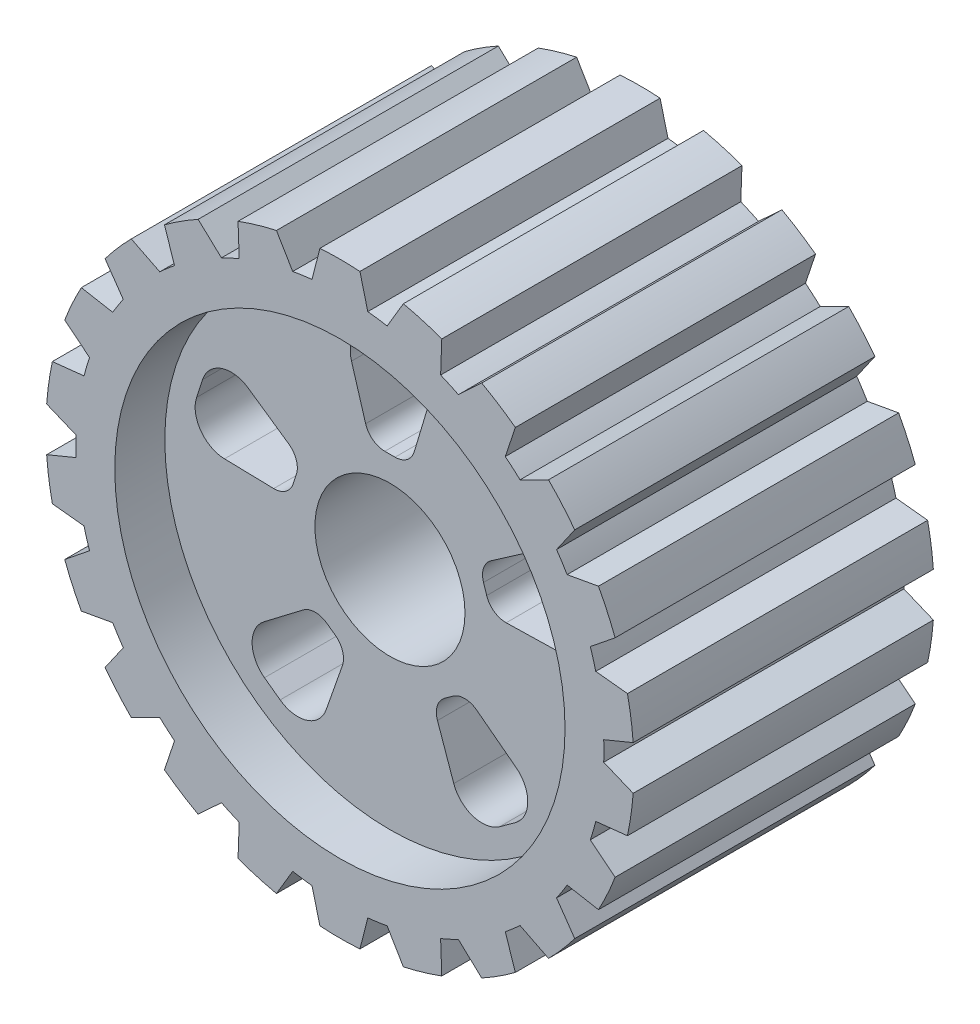
from build123d import *

# Parameters (mm, degrees)
SKETCH_1_R      = 22.5
EXTRUDE_1_DEPTH = 15
SKETCH_2_R      = 22.5
SKETCH_2_R_2    = 7.5
EXTRUDE_2_DEPTH = 10


with BuildPart() as part:
    # Эскиз1 → Бобышка-Вытянуть1 (new, symmetric)
    with BuildSketch(Plane.XY):
        with BuildLine():
            ThreePointArc((2, 29.320868353), (0, 29.389), (-2, 29.320868353))
            Line((-2, 29.320868353), (-2.786729363, 26.234406101))
            ThreePointArc((-2.786729363, 26.234406101), (-3.268466839, 26.178751852), (-3.749099963, 26.114252305))
            ThreePointArc((-3.749099963, 26.114252305), (-3.754550063, 26.11346928), (-3.76, 26.112685117))
            ThreePointArc((-3.76, 26.112685117), (-4.239335727, 26.039161979), (-4.717239065, 25.956840709))
            Line((-4.717239065, 25.956840709), (-6.341657263, 28.696632279))
            ThreePointArc((-6.341657263, 28.696632279), (-8.279838113, 28.198539002), (-10.179629157, 27.569702052))
            Line((-10.179629157, 27.569702052), (-10.064933551, 24.386615932))
            ThreePointArc((-10.064933551, 24.386615932), (-10.511477661, 24.19749494), (-10.954470144, 24.00019808))
            ThreePointArc((-10.954470144, 24.00019808), (-10.959478873, 23.997911301), (-10.964487125, 23.995623478))
            ThreePointArc((-10.964487125, 23.995623478), (-11.403692526, 23.790034064), (-11.839044838, 23.576406455))
            Line((-11.839044838, 23.576406455), (-14.169551169, 25.747565723))
            ThreePointArc((-14.169551169, 25.747565723), (-15.888892984, 24.723600076), (-17.534565301, 23.585002453))
            Line((-17.534565301, 23.585002453), (-16.527736682, 20.563167173))
            ThreePointArc((-16.527736682, 20.563167173), (-16.902911077, 20.255900897), (-17.272374303, 19.94179054))
            ThreePointArc((-17.272374303, 19.94179054), (-17.276535883, 19.938185271), (-17.280696711, 19.934579132))
            ThreePointArc((-17.280696711, 19.934579132), (-17.644189976, 19.613579074), (-18.001721608, 19.285951964))
            Line((-18.001721608, 19.285951964), (-20.84951231, 20.712584519))
            ThreePointArc((-20.84951231, 20.712584519), (-22.210724241, 19.24570211), (-23.468955246, 17.689586221))
            Line((-23.468955246, 17.689586221), (-21.65156088, 15.073812904))
            ThreePointArc((-21.65156088, 15.073812904), (-21.924971162, 14.673294229), (-22.190973418, 14.26781773))
            ThreePointArc((-22.190973418, 14.26781773), (-22.193950703, 14.263186046), (-22.196927022, 14.258553741))
            ThreePointArc((-22.196927022, 14.258553741), (-22.455260088, 13.848148554), (-22.706005954, 13.433064343))
            Line((-22.706005954, 13.433064343), (-25.84036996, 13.999592899))
            ThreePointArc((-25.84036996, 13.999592899), (-26.733174711, 12.208631817), (-27.502030012, 10.361064918))
            Line((-27.502030012, 10.361064918), (-25.021304383, 8.36326796))
            ThreePointArc((-25.021304383, 8.36326796), (-25.170800477, 7.901944528), (-25.311791842, 7.437951181))
            ThreePointArc((-25.311791842, 7.437951181), (-25.31334363, 7.432668315), (-25.314894316, 7.427385125))
            ThreePointArc((-25.314894316, 7.427385125), (-25.447138575, 6.960823396), (-25.570784735, 6.491909738))
            Line((-25.570784735, 6.491909738), (-28.737794514, 6.152437522))
            ThreePointArc((-28.737794514, 6.152437522), (-29.089862355, 4.182490782), (-29.307053867, 2.193151754))
            Line((-29.307053867, 2.193151754), (-26.363970612, 0.975180785))
            ThreePointArc((-26.363970612, 0.975180785), (-26.377441234, 0.490426276), (-26.381999425, 0.005506062))
            ThreePointArc((-26.381999425, 0.005506062), (-26.382, 0), (-26.381999425, -0.005506062))
            ThreePointArc((-26.381999425, -0.005506062), (-26.377441234, -0.490426276), (-26.363970612, -0.975180785))
            Line((-26.363970612, -0.975180785), (-29.307053867, -2.193151754))
            ThreePointArc((-29.307053867, -2.193151754), (-29.089862355, -4.182490782), (-28.737794514, -6.152437522))
            Line((-28.737794514, -6.152437522), (-25.570784735, -6.491909738))
            ThreePointArc((-25.570784735, -6.491909738), (-25.447138575, -6.960823396), (-25.314894316, -7.427385125))
            ThreePointArc((-25.314894316, -7.427385125), (-25.31334363, -7.432668315), (-25.311791842, -7.437951181))
            ThreePointArc((-25.311791842, -7.437951181), (-25.170800477, -7.901944528), (-25.021304383, -8.36326796))
            Line((-25.021304383, -8.36326796), (-27.502030012, -10.361064918))
            ThreePointArc((-27.502030012, -10.361064918), (-26.733174711, -12.208631817), (-25.84036996, -13.999592899))
            Line((-25.84036996, -13.999592899), (-22.706005954, -13.433064343))
            ThreePointArc((-22.706005954, -13.433064343), (-22.455260088, -13.848148554), (-22.196927022, -14.258553741))
            ThreePointArc((-22.196927022, -14.258553741), (-22.193950703, -14.263186046), (-22.190973418, -14.26781773))
            ThreePointArc((-22.190973418, -14.26781773), (-21.924971162, -14.673294229), (-21.65156088, -15.073812904))
            Line((-21.65156088, -15.073812904), (-23.468955246, -17.689586221))
            ThreePointArc((-23.468955246, -17.689586221), (-22.210724241, -19.24570211), (-20.84951231, -20.712584519))
            Line((-20.84951231, -20.712584519), (-18.001721608, -19.285951964))
            ThreePointArc((-18.001721608, -19.285951964), (-17.644189976, -19.613579074), (-17.280696711, -19.934579132))
            ThreePointArc((-17.280696711, -19.934579132), (-17.276535883, -19.938185271), (-17.272374303, -19.94179054))
            ThreePointArc((-17.272374303, -19.94179054), (-16.902911077, -20.255900897), (-16.527736682, -20.563167173))
            Line((-16.527736682, -20.563167173), (-17.534565301, -23.585002453))
            ThreePointArc((-17.534565301, -23.585002453), (-15.888892984, -24.723600076), (-14.169551169, -25.747565723))
            Line((-14.169551169, -25.747565723), (-11.839044838, -23.576406455))
            ThreePointArc((-11.839044838, -23.576406455), (-11.403692526, -23.790034064), (-10.964487125, -23.995623478))
            ThreePointArc((-10.964487125, -23.995623478), (-10.959478873, -23.997911301), (-10.954470144, -24.00019808))
            ThreePointArc((-10.954470144, -24.00019808), (-10.511477661, -24.19749494), (-10.064933551, -24.386615932))
            Line((-10.064933551, -24.386615932), (-10.179629157, -27.569702052))
            ThreePointArc((-10.179629157, -27.569702052), (-8.279838113, -28.198539002), (-6.341657263, -28.696632279))
            Line((-6.341657263, -28.696632279), (-4.717239065, -25.956840709))
            ThreePointArc((-4.717239065, -25.956840709), (-4.239335727, -26.039161979), (-3.76, -26.112685117))
            ThreePointArc((-3.76, -26.112685117), (-3.754550063, -26.11346928), (-3.749099963, -26.114252305))
            ThreePointArc((-3.749099963, -26.114252305), (-3.268466839, -26.178751852), (-2.786729363, -26.234406101))
            Line((-2.786729363, -26.234406101), (-2, -29.320868353))
            ThreePointArc((-2, -29.320868353), (0, -29.389), (2, -29.320868353))
            Line((2, -29.320868353), (2.786729363, -26.234406101))
            ThreePointArc((2.786729363, -26.234406101), (3.268466839, -26.178751852), (3.749099963, -26.114252305))
            ThreePointArc((3.749099963, -26.114252305), (3.754550063, -26.11346928), (3.76, -26.112685117))
            ThreePointArc((3.76, -26.112685117), (4.239335727, -26.039161979), (4.717239065, -25.956840709))
            Line((4.717239065, -25.956840709), (6.341657263, -28.696632279))
            ThreePointArc((6.341657263, -28.696632279), (8.279838113, -28.198539002), (10.179629157, -27.569702052))
            Line((10.179629157, -27.569702052), (10.064933551, -24.386615932))
            ThreePointArc((10.064933551, -24.386615932), (10.511477661, -24.19749494), (10.954470144, -24.00019808))
            ThreePointArc((10.954470144, -24.00019808), (10.959478873, -23.997911301), (10.964487125, -23.995623478))
            ThreePointArc((10.964487125, -23.995623478), (11.403692526, -23.790034064), (11.839044838, -23.576406455))
            Line((11.839044838, -23.576406455), (14.169551169, -25.747565723))
            ThreePointArc((14.169551169, -25.747565723), (15.888892984, -24.723600076), (17.534565301, -23.585002453))
            Line((17.534565301, -23.585002453), (16.527736682, -20.563167173))
            ThreePointArc((16.527736682, -20.563167173), (16.902911077, -20.255900897), (17.272374303, -19.94179054))
            ThreePointArc((17.272374303, -19.94179054), (17.276535883, -19.938185271), (17.280696711, -19.934579132))
            ThreePointArc((17.280696711, -19.934579132), (17.644189976, -19.613579074), (18.001721608, -19.285951964))
            Line((18.001721608, -19.285951964), (20.84951231, -20.712584519))
            ThreePointArc((20.84951231, -20.712584519), (22.210724241, -19.24570211), (23.468955246, -17.689586221))
            Line((23.468955246, -17.689586221), (21.65156088, -15.073812904))
            ThreePointArc((21.65156088, -15.073812904), (21.924971162, -14.673294229), (22.190973418, -14.26781773))
            ThreePointArc((22.190973418, -14.26781773), (22.193950703, -14.263186046), (22.196927022, -14.258553741))
            ThreePointArc((22.196927022, -14.258553741), (22.455260088, -13.848148554), (22.706005954, -13.433064343))
            Line((22.706005954, -13.433064343), (25.84036996, -13.999592899))
            ThreePointArc((25.84036996, -13.999592899), (26.733174711, -12.208631817), (27.502030012, -10.361064918))
            Line((27.502030012, -10.361064918), (25.021304383, -8.36326796))
            ThreePointArc((25.021304383, -8.36326796), (25.170800477, -7.901944528), (25.311791842, -7.437951181))
            ThreePointArc((25.311791842, -7.437951181), (25.31334363, -7.432668315), (25.314894316, -7.427385125))
            ThreePointArc((25.314894316, -7.427385125), (25.447138575, -6.960823396), (25.570784735, -6.491909738))
            Line((25.570784735, -6.491909738), (28.737794514, -6.152437522))
            ThreePointArc((28.737794514, -6.152437522), (29.089862355, -4.182490782), (29.307053867, -2.193151754))
            Line((29.307053867, -2.193151754), (26.363970612, -0.975180785))
            ThreePointArc((26.363970612, -0.975180785), (26.377441234, -0.490426276), (26.381999425, -0.005506062))
            ThreePointArc((26.381999425, -0.005506062), (26.382, 0), (26.381999425, 0.005506062))
            ThreePointArc((26.381999425, 0.005506062), (26.377441234, 0.490426276), (26.363970612, 0.975180785))
            Line((26.363970612, 0.975180785), (29.307053867, 2.193151754))
            ThreePointArc((29.307053867, 2.193151754), (29.089862355, 4.182490782), (28.737794514, 6.152437522))
            Line((28.737794514, 6.152437522), (25.570784735, 6.491909738))
            ThreePointArc((25.570784735, 6.491909738), (25.447138575, 6.960823396), (25.314894316, 7.427385125))
            ThreePointArc((25.314894316, 7.427385125), (25.31334363, 7.432668315), (25.311791842, 7.437951181))
            ThreePointArc((25.311791842, 7.437951181), (25.170800477, 7.901944528), (25.021304383, 8.36326796))
            Line((25.021304383, 8.36326796), (27.502030012, 10.361064918))
            ThreePointArc((27.502030012, 10.361064918), (26.733174711, 12.208631817), (25.84036996, 13.999592899))
            Line((25.84036996, 13.999592899), (22.706005954, 13.433064343))
            ThreePointArc((22.706005954, 13.433064343), (22.455260088, 13.848148554), (22.196927022, 14.258553741))
            ThreePointArc((22.196927022, 14.258553741), (22.193950703, 14.263186046), (22.190973418, 14.26781773))
            ThreePointArc((22.190973418, 14.26781773), (21.924971162, 14.673294229), (21.65156088, 15.073812904))
            Line((21.65156088, 15.073812904), (23.468955246, 17.689586221))
            ThreePointArc((23.468955246, 17.689586221), (22.210724241, 19.24570211), (20.84951231, 20.712584519))
            Line((20.84951231, 20.712584519), (18.001721608, 19.285951964))
            ThreePointArc((18.001721608, 19.285951964), (17.644189976, 19.613579074), (17.280696711, 19.934579132))
            ThreePointArc((17.280696711, 19.934579132), (17.276535883, 19.938185271), (17.272374303, 19.94179054))
            ThreePointArc((17.272374303, 19.94179054), (16.902911077, 20.255900897), (16.527736682, 20.563167173))
            Line((16.527736682, 20.563167173), (17.534565301, 23.585002453))
            ThreePointArc((17.534565301, 23.585002453), (15.888892984, 24.723600076), (14.169551169, 25.747565723))
            Line((14.169551169, 25.747565723), (11.839044838, 23.576406455))
            ThreePointArc((11.839044838, 23.576406455), (11.403692526, 23.790034064), (10.964487125, 23.995623478))
            ThreePointArc((10.964487125, 23.995623478), (10.959478873, 23.997911301), (10.954470144, 24.00019808))
            ThreePointArc((10.954470144, 24.00019808), (10.511477661, 24.19749494), (10.064933551, 24.386615932))
            Line((10.064933551, 24.386615932), (10.179629157, 27.569702052))
            ThreePointArc((10.179629157, 27.569702052), (8.279838113, 28.198539002), (6.341657263, 28.696632279))
            Line((6.341657263, 28.696632279), (4.717239065, 25.956840709))
            ThreePointArc((4.717239065, 25.956840709), (4.239335727, 26.039161979), (3.76, 26.112685117))
            ThreePointArc((3.76, 26.112685117), (3.754550063, 26.11346928), (3.749099963, 26.114252305))
            ThreePointArc((3.749099963, 26.114252305), (3.268466839, 26.178751852), (2.786729363, 26.234406101))
            Line((2.786729363, 26.234406101), (2, 29.320868353))
        make_face()
        Circle(SKETCH_1_R, mode=Mode.SUBTRACT)
    extrude(amount=EXTRUDE_1_DEPTH, both=True)

    # Эскиз2 → Бобышка-Вытянуть2 (add, symmetric)
    with BuildSketch(Plane.XY):
        Circle(SKETCH_2_R)
        Circle(SKETCH_2_R_2, mode=Mode.SUBTRACT)
        with BuildLine():
            Line((-0.967908047, 20), (0.967908047, 20))
            ThreePointArc((0.967908047, 20), (3.374786832, 18.790791589), (3.841386903, 16.137956343))
            Line((3.841386903, 16.137956343), (2.427591269, 11.425304229))
            ThreePointArc((2.427591269, 11.425304229), (1.705799757, 10.395414143), (0.511938698, 10))
            Line((0.511938698, 10), (-0.511938698, 10))
            ThreePointArc((-0.511938698, 10), (-1.705799757, 10.395414143), (-2.427591269, 11.425304229))
            Line((-2.427591269, 11.425304229), (-3.841386903, 16.137956343))
            ThreePointArc((-3.841386903, 16.137956343), (-3.374786832, 18.790791589), (-0.967908047, 20))
        make_face(mode=Mode.SUBTRACT)
        with BuildLine():
            Line((18.72203029, 7.100875143), (19.320230362, 5.259804632))
            ThreePointArc((19.320230362, 5.259804632), (18.913971271, 2.597060931), (16.535162375, 1.333526719))
            Line((16.535162375, 1.333526719), (11.616276995, 1.221836678))
            ThreePointArc((11.616276995, 1.221836678), (10.413747475, 1.590047659), (9.668762921, 2.603287309))
            Line((9.668762921, 2.603287309), (9.352367405, 3.577052579))
            ThreePointArc((9.352367405, 3.577052579), (9.359505247, 4.834671609), (10.11594308, 5.839389668))
            Line((10.11594308, 5.839389668), (14.161054705, 8.64027881))
            ThreePointArc((14.161054705, 8.64027881), (16.828238303, 9.016286947), (18.72203029, 7.100875143))
        make_face(mode=Mode.SUBTRACT)
        with BuildLine():
            Line((12.538759105, -15.611417812), (10.972650987, -16.749261963))
            ThreePointArc((10.972650987, -16.749261963), (8.314690275, -17.185719663), (6.377905454, -15.313791506))
            Line((6.377905454, -15.313791506), (4.751662737, -10.670167633))
            ThreePointArc((4.751662737, -10.670167633), (4.730250132, -9.412710646), (5.463685416, -8.391079961))
            Line((5.463685416, -8.391079961), (6.29201963, -7.789259927))
            ThreePointArc((6.29201963, -7.789259927), (7.490292118, -7.407422765), (8.67958792, -7.816362941))
            Line((8.67958792, -7.816362941), (12.593400027, -10.797970366))
            ThreePointArc((12.593400027, -10.797970366), (13.775210075, -13.218419804), (12.538759105, -15.611417812))
        make_face(mode=Mode.SUBTRACT)
        with BuildLine():
            Line((-10.972650987, -16.749261963), (-12.538759105, -15.611417812))
            ThreePointArc((-12.538759105, -15.611417812), (-13.775210075, -13.218419804), (-12.593400027, -10.797970366))
            Line((-12.593400027, -10.797970366), (-8.67958792, -7.816362941))
            ThreePointArc((-8.67958792, -7.816362941), (-7.490292118, -7.407422765), (-6.29201963, -7.789259927))
            Line((-6.29201963, -7.789259927), (-5.463685416, -8.391079961))
            ThreePointArc((-5.463685416, -8.391079961), (-4.730250132, -9.412710646), (-4.751662737, -10.670167633))
            Line((-4.751662737, -10.670167633), (-6.377905454, -15.313791506))
            ThreePointArc((-6.377905454, -15.313791506), (-8.314690275, -17.185719663), (-10.972650987, -16.749261963))
        make_face(mode=Mode.SUBTRACT)
        with BuildLine():
            Line((-19.320230362, 5.259804632), (-18.72203029, 7.100875143))
            ThreePointArc((-18.72203029, 7.100875143), (-16.828238303, 9.016286947), (-14.161054705, 8.64027881))
            Line((-14.161054705, 8.64027881), (-10.11594308, 5.839389668))
            ThreePointArc((-10.11594308, 5.839389668), (-9.359505247, 4.834671609), (-9.352367405, 3.577052579))
            Line((-9.352367405, 3.577052579), (-9.668762921, 2.603287309))
            ThreePointArc((-9.668762921, 2.603287309), (-10.413747475, 1.590047659), (-11.616276995, 1.221836678))
            Line((-11.616276995, 1.221836678), (-16.535162375, 1.333526719))
            ThreePointArc((-16.535162375, 1.333526719), (-18.913971271, 2.597060931), (-19.320230362, 5.259804632))
        make_face(mode=Mode.SUBTRACT)
    extrude(amount=EXTRUDE_2_DEPTH, both=True)


solid = part.part
